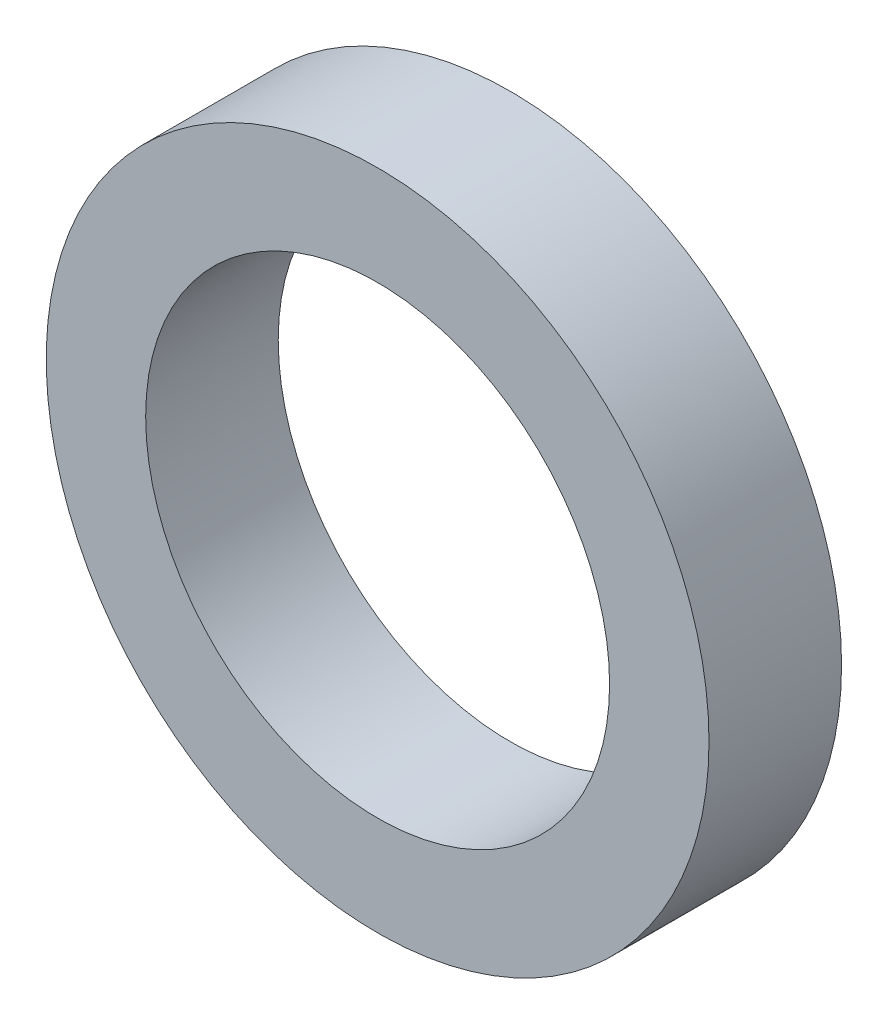
from build123d import *

# Parameters (mm, degrees)
SKETCH_1_R      = 20
SKETCH_1_R_2    = 14
EXTRUDE_1_DEPTH = 8


with BuildPart() as part:
    # Эскиз1 → Бобышка-Вытянуть1 (new body)
    with BuildSketch(Plane.XY):
        Circle(SKETCH_1_R)
        Circle(SKETCH_1_R_2, mode=Mode.SUBTRACT)
    extrude(amount=EXTRUDE_1_DEPTH)


solid = part.part
